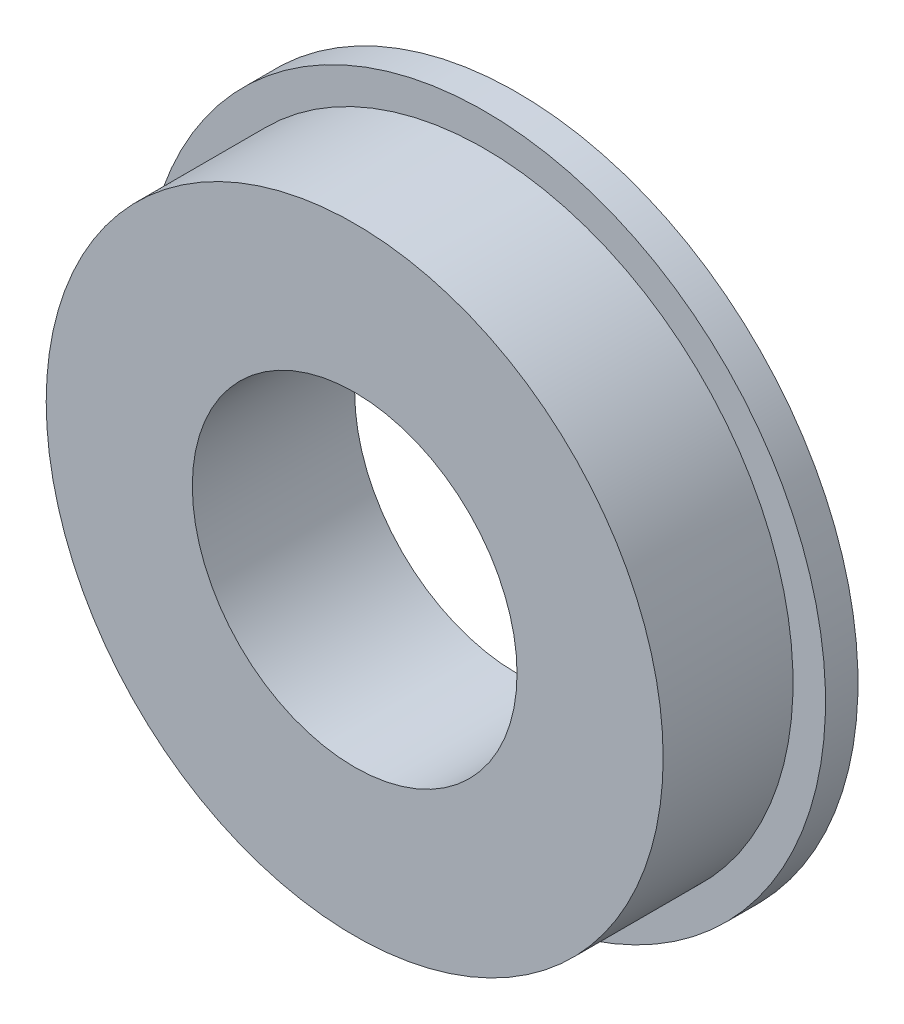
from build123d import *

# Parameters (mm, degrees)
SKETCH_1_R      = 9.5
SKETCH_1_R_2    = 5
EXTRUDE_1_DEPTH = 5
SKETCH_2_R      = 10.5
SKETCH_2_R_2    = 5
EXTRUDE_2_DEPTH = 1


with BuildPart() as part:
    # 草图1 → 凸台-拉伸1 (new body)
    with BuildSketch(Plane.XY):
        Circle(SKETCH_1_R)
        Circle(SKETCH_1_R_2, mode=Mode.SUBTRACT)
    extrude(amount=EXTRUDE_1_DEPTH)

    # 草图2 → 凸台-拉伸2 (add)
    with BuildSketch(Plane(origin=(0, 0, 0), x_dir=(-1, 0, 0), z_dir=(0, 0, -1))):
        Circle(SKETCH_2_R)
        with Locations(Location((0, 0, 0), (0, 0, 180))):
            Circle(SKETCH_2_R_2, mode=Mode.SUBTRACT)
    extrude(amount=-EXTRUDE_2_DEPTH)


solid = part.part
